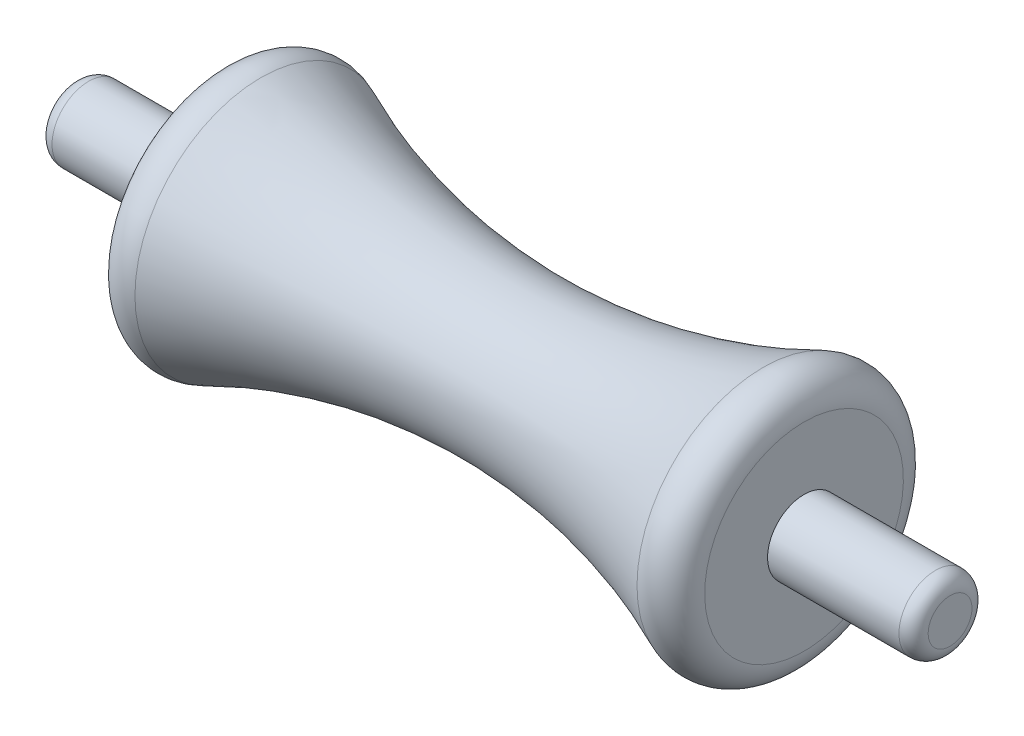
from build123d import *


with BuildPart() as part:
    # Sketch1 → Revolve1 (revolve)
    with BuildSketch(Plane.XY, mode=Mode.PRIVATE) as revolve1_sk:
        with BuildLine():
            Line((60, 0), (-60, 0))
            Line((-60, 0), (-60, -3))
            ThreePointArc((-60, -3), (-59.414213562, -4.414213562), (-58, -5))
            Line((-58, -5), (-40, -5))
            Line((-40, -5), (-40, -13.60589702))
            ThreePointArc((-40, -13.60589702), (-38.182669225, -16.957904635), (-34.382022472, -17.264058951))
            ThreePointArc((-34.382022472, -17.264058951), (0, -10), (34.382022472, -17.264058951))
            ThreePointArc((34.382022472, -17.264058951), (38.182669225, -16.957904635), (40, -13.60589702))
            Line((40, -13.60589702), (40, -5))
            Line((40, -5), (58, -5))
            ThreePointArc((58, -5), (59.414213562, -4.414213562), (60, -3))
            Line((60, -3), (60, 0))
        make_face()
    revolve(revolve1_sk.sketch.rotate(Axis((60, 0, 0), (-1, 0, 0)), 180), axis=Axis((60, 0, 0), (-1, 0, 0)))


solid = part.part
